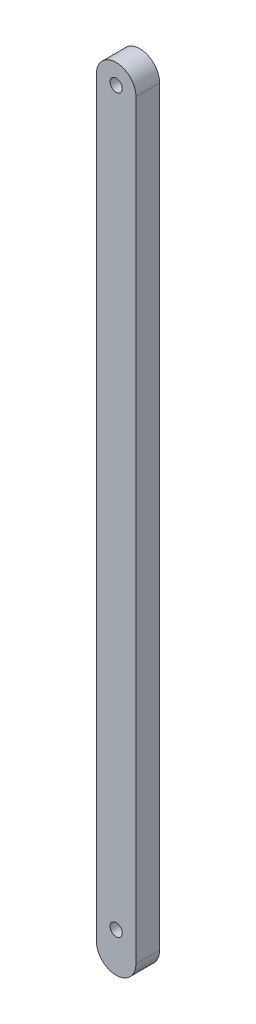
from build123d import *

# Parameters (mm, degrees)
BOSS_EXTRU_1_DEPTH      = 6
ESQUISSE4_R             = 1.55
ENL_V_MAT_EXTRU_3_DEPTH = 6


with BuildPart() as part:
    # Esquisse3 → Boss.-Extru.1 (new body)
    with BuildSketch(Plane.XY):
        with BuildLine():
            Line((-7, -132), (-7, 58))
            ThreePointArc((-7, 58), (-2, 63), (3, 58))
            Line((3, 58), (3, -132))
            ThreePointArc((3, -132), (-2, -137), (-7, -132))
        make_face()
    extrude(amount=BOSS_EXTRU_1_DEPTH)

    # Esquisse4 → Enlèv. mat.-Extru.3 (cut)
    with BuildSketch(Plane(origin=(0, 0, 0), x_dir=(-1, 0, 0), z_dir=(0, 0, -1))):
        with Locations((2, -127)):
            Circle(ESQUISSE4_R)
        with Locations(Location((2, 58, 0), (0, 0, 180))):
            Circle(ESQUISSE4_R)
    extrude(amount=-ENL_V_MAT_EXTRU_3_DEPTH, mode=Mode.SUBTRACT)


solid = part.part
